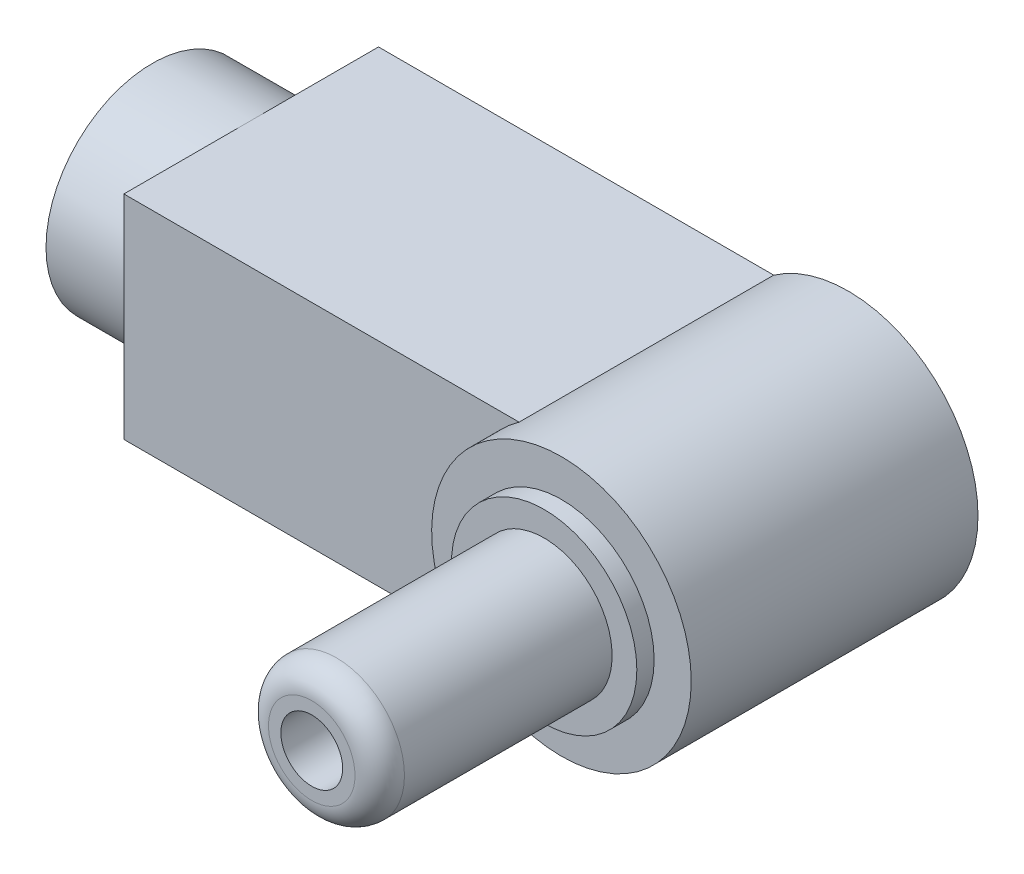
from build123d import *

# Parameters (mm, degrees)
BOSS_EXTRUDE1_DEPTH = 10.3
SKETCH2_R           = 5.25
BOSS_EXTRUDE2_DEPTH = 1.3
SKETCH3_R           = 3.75
BOSS_EXTRUDE3_DEPTH = 0.7
SKETCH4_R           = 2.75
SKETCH4_R_2         = 1.25
BOSS_EXTRUDE4_DEPTH = 9.4
FILLET1_R           = 1
SKETCH5_R           = 4.3
SKETCH5_R_2         = 2.75
BOSS_EXTRUDE5_DEPTH = 4


with BuildPart() as part:
    # Sketch1 → Boss-Extrude1 (new body)
    with BuildSketch(Plane.XY):
        with BuildLine():
            Line((-3.012059096, 4.3), (-19, 4.3))
            Line((-19, 4.3), (-19, -4.3))
            Line((-19, -4.3), (-3.012059096, -4.3))
            ThreePointArc((-3.012059096, -4.3), (5.25, 0), (-3.012059096, 4.3))
        make_face()
    extrude(amount=BOSS_EXTRUDE1_DEPTH)

    # Sketch2 → Boss-Extrude2 (add)
    with BuildSketch(Plane.XY.offset(10.3)):
        with Locations(Location((0, 0, 0), (0, 0, 125.010429905))):
            Circle(SKETCH2_R)
    extrude(amount=BOSS_EXTRUDE2_DEPTH)

    # Sketch3 → Boss-Extrude3 (add)
    with BuildSketch(Plane.XY.offset(11.6)):
        Circle(SKETCH3_R)
    extrude(amount=BOSS_EXTRUDE3_DEPTH)

    # Sketch4 → Boss-Extrude4 (add)
    with BuildSketch(Plane.XY.offset(12.3)):
        with Locations(Location((0, 0, 0), (0, 0, 180))):
            Circle(SKETCH4_R)
        with Locations(Location((0, 0, 0), (0, 0, 180))):
            Circle(SKETCH4_R_2, mode=Mode.SUBTRACT)
    extrude(amount=BOSS_EXTRUDE4_DEPTH)

    # Fillet1
    fillet1_edges = [part.edges().sort_by_distance(p)[0] for p in [
        (2.75, 0, 21.7),
    ]]
    fillet(fillet1_edges, radius=FILLET1_R)

    # Sketch5 → Boss-Extrude5 (add)
    with BuildSketch(Plane.ZY.offset(19)):
        with Locations(Location((5.15, 0, 0), (0, 0, 270))):
            Circle(SKETCH5_R)
        with Locations((5.15, 0)):
            Circle(SKETCH5_R_2, mode=Mode.SUBTRACT)
    extrude(amount=BOSS_EXTRUDE5_DEPTH)


solid = part.part
